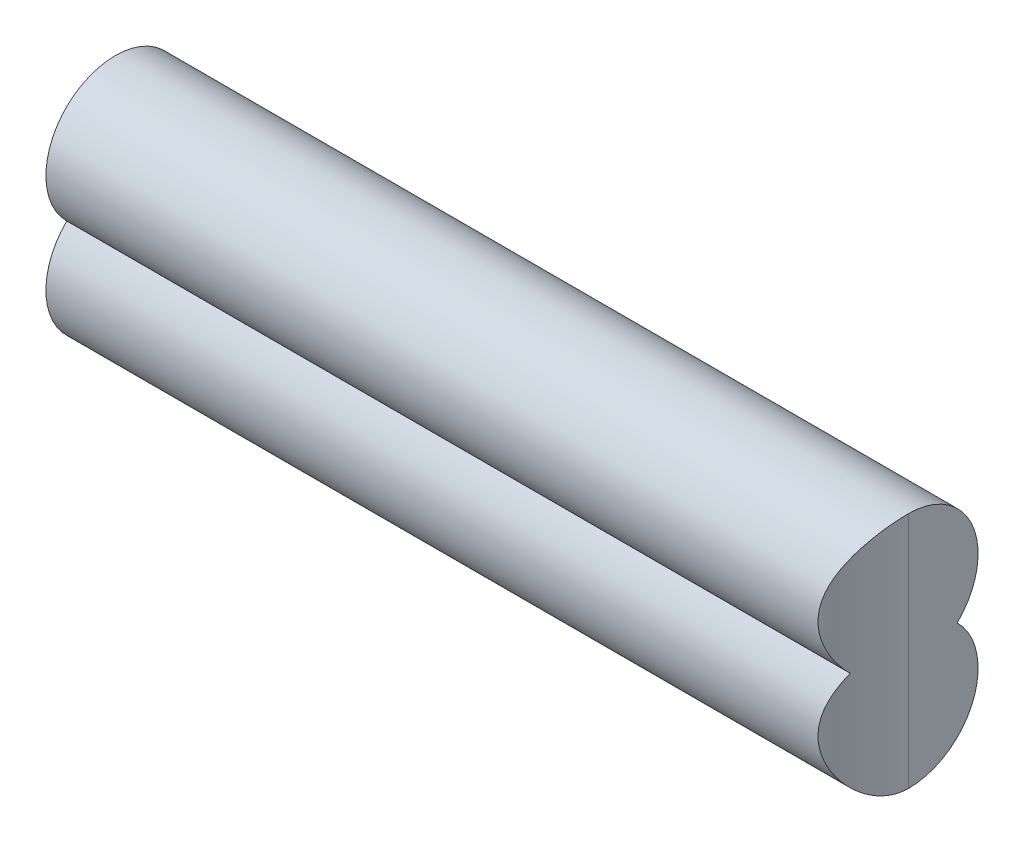
from build123d import *

# Parameters (mm, degrees)
SKETCH2_W           = 12.7
SKETCH2_H           = 12.7
BOSS_EXTRUDE1_DEPTH = 40.64
FILLET1_R           = 6.35
SKETCH3_W           = 12.7
SKETCH3_H           = 12.7
CUT_EXTRUDE2_DEPTH  = 42.620362805


with BuildPart() as part:
    # Sketch2 → Boss-Extrude1 (new body)
    with BuildSketch(Plane(origin=(0, 0, 0), x_dir=(0, 0, -1), z_dir=(1, 0, 0))):
        Rectangle(SKETCH2_W, SKETCH2_H)
    extrude(amount=BOSS_EXTRUDE1_DEPTH)

    # Fillet1
    fillet1_edges = [part.edges().sort_by_distance(p)[0] for p in [
        (40.64, 0, 6.35),
    ]]
    fillet(fillet1_edges, radius=FILLET1_R)

    # Sketch3 → Cut-Extrude2 (cut, through all)
    with BuildSketch(Plane.ZY):
        Rectangle(SKETCH3_W, SKETCH3_H)
        with BuildLine():
            ThreePointArc((2.488681579, 0), (3.278329429, -1.162432523), (3.556, -2.54))
            ThreePointArc((3.556, -2.54), (-1.377567477, -5.818329429), (-2.488681579, 0))
            ThreePointArc((-2.488681579, 0), (-1.377567477, 5.818329429), (3.556, 2.54))
            ThreePointArc((3.556, 2.54), (3.278329429, 1.162432523), (2.488681579, 0))
        make_face(mode=Mode.SUBTRACT)
    extrude(amount=-CUT_EXTRUDE2_DEPTH, mode=Mode.SUBTRACT)


solid = part.part
